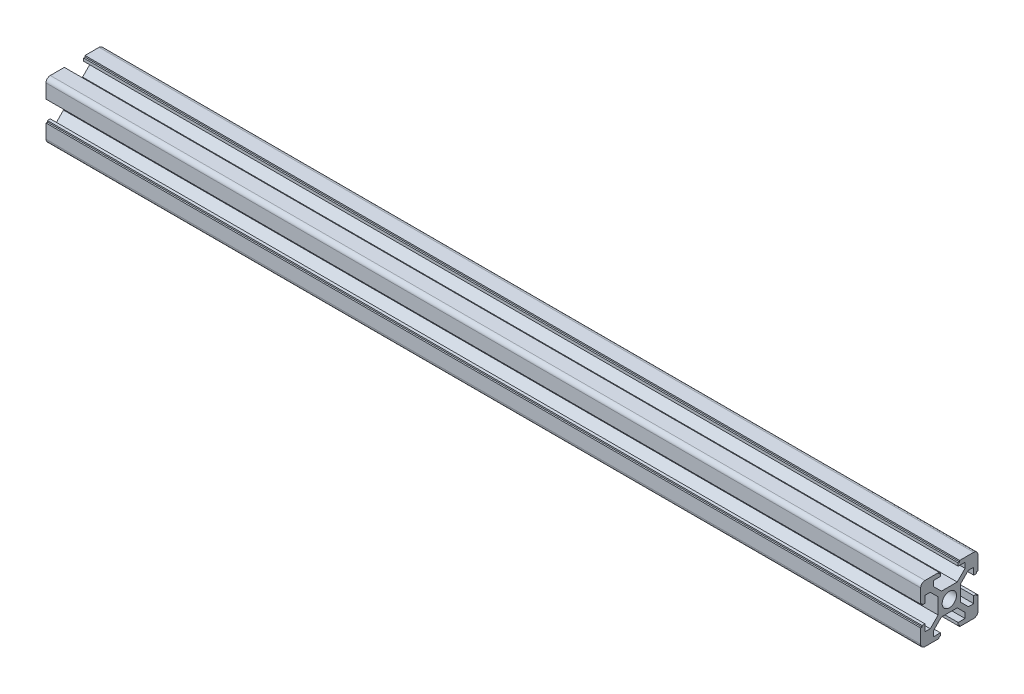
from build123d import *

# Parameters (mm, degrees)
SKETCH1_R                = 2.5
F_20_X_20_X_R1_5_1_DEPTH = 305


with BuildPart() as part:
    # Sketch1 → 铝型材 20 X 20 X R1.5(1) (new body)
    with BuildSketch(Plane.YZ):
        with BuildLine():
            Line((-3.6, 10), (-3.6, 9.5))
            Line((-3.6, 9.5), (-3.1, 9.5))
            Line((-3.1, 9.5), (-3.1, 8.5))
            Line((-3.1, 8.5), (-5.5, 8.5))
            Line((-5.5, 8.5), (-5.5, 6.65))
            Line((-5.5, 6.65), (-2.75, 3.9))
            Line((-2.75, 3.9), (2.75, 3.9))
            Line((2.75, 3.9), (5.5, 6.65))
            Line((5.5, 6.65), (5.5, 8.5))
            Line((5.5, 8.5), (3.1, 8.5))
            Line((3.1, 8.5), (3.1, 9.5))
            Line((3.1, 9.5), (3.6, 9.5))
            Line((3.6, 9.5), (3.6, 10))
            Line((3.6, 10), (8.5, 10))
            ThreePointArc((8.5, 10), (9.560660172, 9.560660172), (10, 8.5))
            Line((10, 8.5), (10, 3.6))
            Line((10, 3.6), (9.5, 3.6))
            Line((9.5, 3.6), (9.5, 3.1))
            Line((9.5, 3.1), (8.5, 3.1))
            Line((8.5, 3.1), (8.5, 5.5))
            Line((8.5, 5.5), (6.65, 5.5))
            Line((6.65, 5.5), (3.9, 2.75))
            Line((3.9, 2.75), (3.9, -2.75))
            Line((3.9, -2.75), (6.65, -5.5))
            Line((6.65, -5.5), (8.5, -5.5))
            Line((8.5, -5.5), (8.5, -3.1))
            Line((8.5, -3.1), (9.5, -3.1))
            Line((9.5, -3.1), (9.5, -3.6))
            Line((9.5, -3.6), (10, -3.6))
            Line((10, -3.6), (10, -8.5))
            ThreePointArc((10, -8.5), (9.560660172, -9.560660172), (8.5, -10))
            Line((8.5, -10), (3.6, -10))
            Line((3.6, -10), (3.6, -9.5))
            Line((3.6, -9.5), (3.1, -9.5))
            Line((3.1, -9.5), (3.1, -8.5))
            Line((3.1, -8.5), (5.5, -8.5))
            Line((5.5, -8.5), (5.5, -6.65))
            Line((5.5, -6.65), (2.75, -3.9))
            Line((2.75, -3.9), (-2.75, -3.9))
            Line((-2.75, -3.9), (-5.5, -6.65))
            Line((-5.5, -6.65), (-5.5, -8.5))
            Line((-5.5, -8.5), (-3.1, -8.5))
            Line((-3.1, -8.5), (-3.1, -9.5))
            Line((-3.1, -9.5), (-3.6, -9.5))
            Line((-3.6, -9.5), (-3.6, -10))
            Line((-3.6, -10), (-8.5, -10))
            ThreePointArc((-8.5, -10), (-9.560660172, -9.560660172), (-10, -8.5))
            Line((-10, -8.5), (-10, -3.6))
            Line((-10, -3.6), (-9.5, -3.6))
            Line((-9.5, -3.6), (-9.5, -3.1))
            Line((-9.5, -3.1), (-8.5, -3.1))
            Line((-8.5, -3.1), (-8.5, -5.5))
            Line((-8.5, -5.5), (-6.65, -5.5))
            Line((-6.65, -5.5), (-3.9, -2.75))
            Line((-3.9, -2.75), (-3.9, 2.75))
            Line((-3.9, 2.75), (-6.65, 5.5))
            Line((-6.65, 5.5), (-8.5, 5.5))
            Line((-8.5, 5.5), (-8.5, 3.1))
            Line((-8.5, 3.1), (-9.5, 3.1))
            Line((-9.5, 3.1), (-9.5, 3.6))
            Line((-9.5, 3.6), (-10, 3.6))
            Line((-10, 3.6), (-10, 8.5))
            ThreePointArc((-10, 8.5), (-9.560660172, 9.560660172), (-8.5, 10))
            Line((-8.5, 10), (-3.6, 10))
        make_face()
        Circle(SKETCH1_R, mode=Mode.SUBTRACT)
    extrude(amount=F_20_X_20_X_R1_5_1_DEPTH)


solid = part.part
